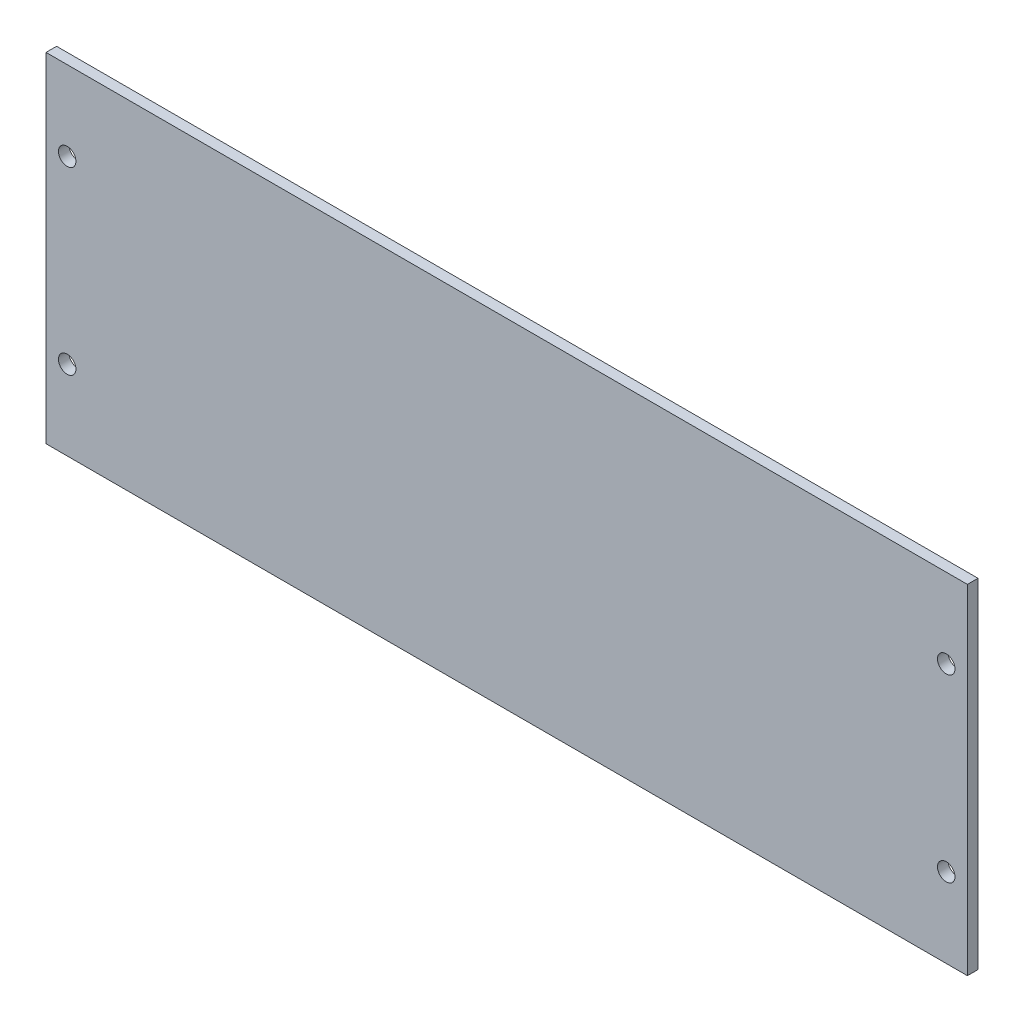
from build123d import *

# Parameters (mm, degrees)
ESQUISSE1_W        = 348
ESQUISSE1_H        = 128
BOSS_EXTRU_1_DEPTH = 4
D_GAGEMENT_M61_D   = 6.6


with BuildPart() as part:
    # Esquisse1 → Boss.-Extru.1 (new body)
    with BuildSketch(Plane.XY):
        Rectangle(ESQUISSE1_W, ESQUISSE1_H)
    extrude(amount=BOSS_EXTRU_1_DEPTH)

    # Dégagement M61 (through all)
    with Locations(Plane(origin=(0, 0, 0), x_dir=(-1, 0, 0), z_dir=(0, 0, -1))):
        with Locations((166, 34), (-166, 34), (166, -34), (-166, -34)):
            Hole(D_GAGEMENT_M61_D / 2)


solid = part.part
